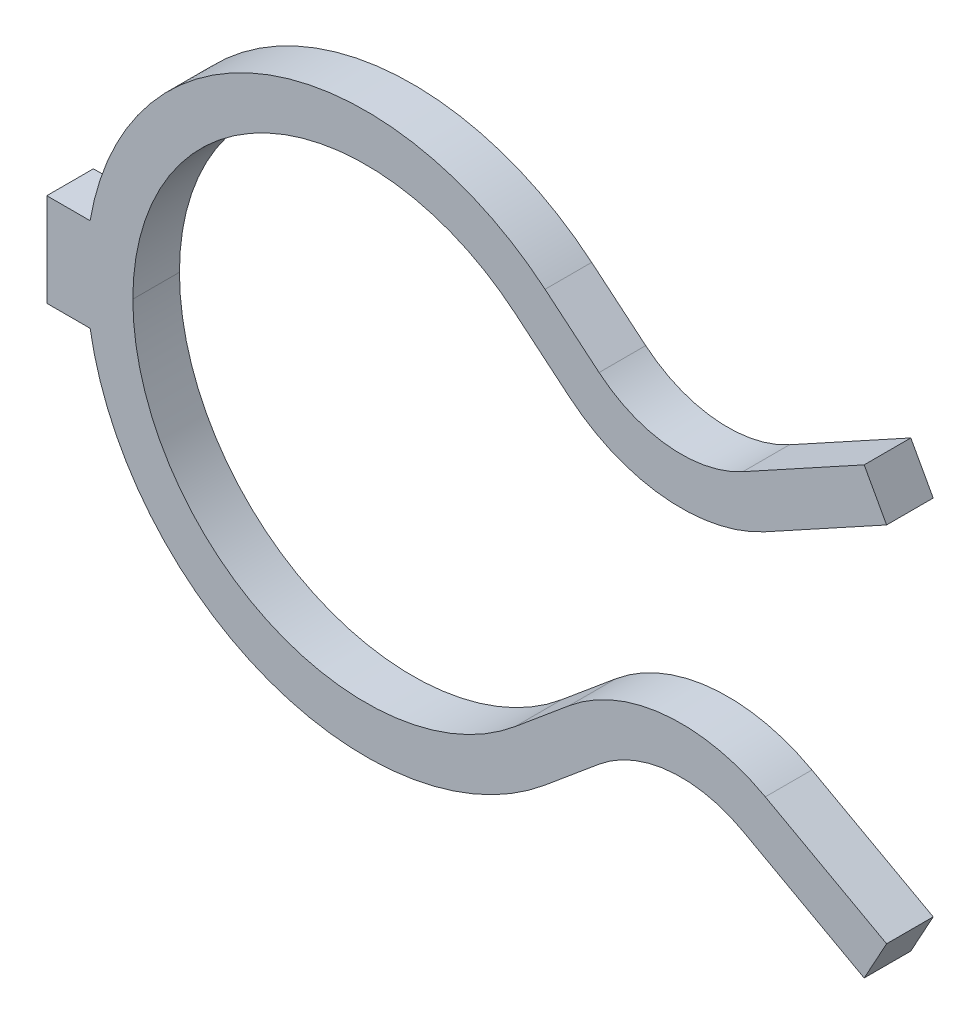
from build123d import *

# Parameters (mm, degrees)
EXTRUDE1_DEPTH = 5.08


with BuildPart() as part:
    # Sketch1 → Extrude1 (new body)
    with BuildSketch(Plane.XY):
        with BuildLine():
            Line((16.277171033, 19.499069289), (22.162906601, 14.585854045))
            ThreePointArc((22.162906601, 14.585854045), (32.529038116, 10.249394717), (43.535952824, 12.509790851))
            Line((43.535952824, 12.509790851), (56.757436861, 19.765747267))
            Line((56.757436861, 19.765747267), (54.313392075, 24.219177976))
            Line((54.313392075, 24.219177976), (41.091908038, 16.963221561))
            ThreePointArc((41.091908038, 16.963221561), (33.020170585, 15.305597729), (25.418340808, 18.485667902))
            Line((25.418340808, 18.485667902), (19.53260524, 23.398883147))
            ThreePointArc((19.53260524, 23.398883147), (-10.562606276, 28.591287985), (-30.053685298, 5.08))
            Line((-30.053685298, 5.08), (-34.776815298, 5.08))
            Line((-34.776815298, 5.08), (-34.776815298, -5.08))
            Line((-34.776815298, -5.08), (-30.053685298, -5.08))
            ThreePointArc((-30.053685298, -5.08), (-10.562606276, -28.591287985), (19.53260524, -23.398883147))
            Line((19.53260524, -23.398883147), (25.418340808, -18.485667902))
            ThreePointArc((25.418340808, -18.485667902), (33.020170585, -15.305597729), (41.091908038, -16.963221561))
            Line((41.091908038, -16.963221561), (54.313392075, -24.219177976))
            Line((54.313392075, -24.219177976), (56.757436861, -19.765747267))
            Line((56.757436861, -19.765747267), (43.535952824, -12.509790851))
            ThreePointArc((43.535952824, -12.509790851), (32.529038116, -10.249394717), (22.162906601, -14.585854045))
            Line((22.162906601, -14.585854045), (16.277171033, -19.499069289))
            ThreePointArc((16.277171033, -19.499069289), (-25.4, 0), (16.277171033, 19.499069289))
        make_face()
    extrude(amount=EXTRUDE1_DEPTH)


solid = part.part
